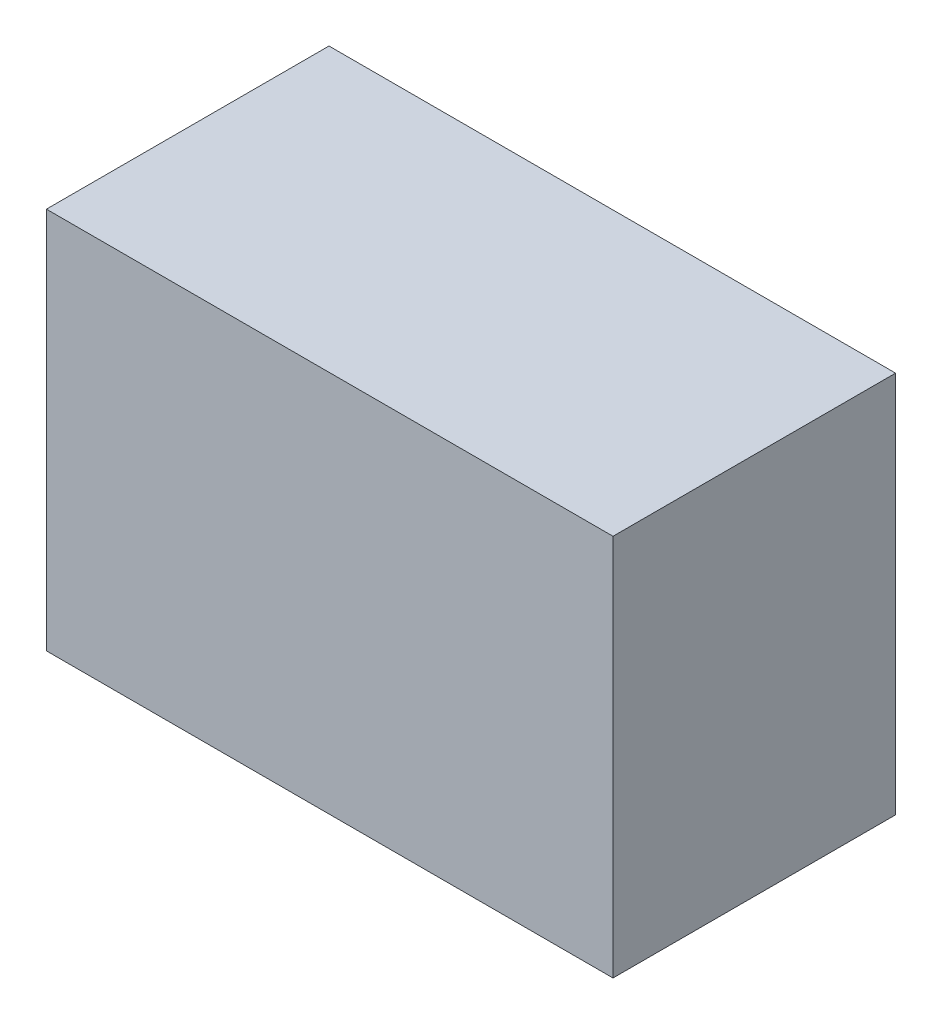
from build123d import *

# Parameters (mm, degrees)
SKETCH1_W               = 7.8199996
SKETCH1_H               = 5.2799996
COMPONENT_OUTLINE_DEPTH = 3.8999922


with BuildPart() as part:
    # Sketch1 → Component_Outline (new body)
    with BuildSketch(Plane.XY):
        with Locations((2.54, 1.27)):
            Rectangle(SKETCH1_W, SKETCH1_H)
    extrude(amount=COMPONENT_OUTLINE_DEPTH)


solid = part.part
